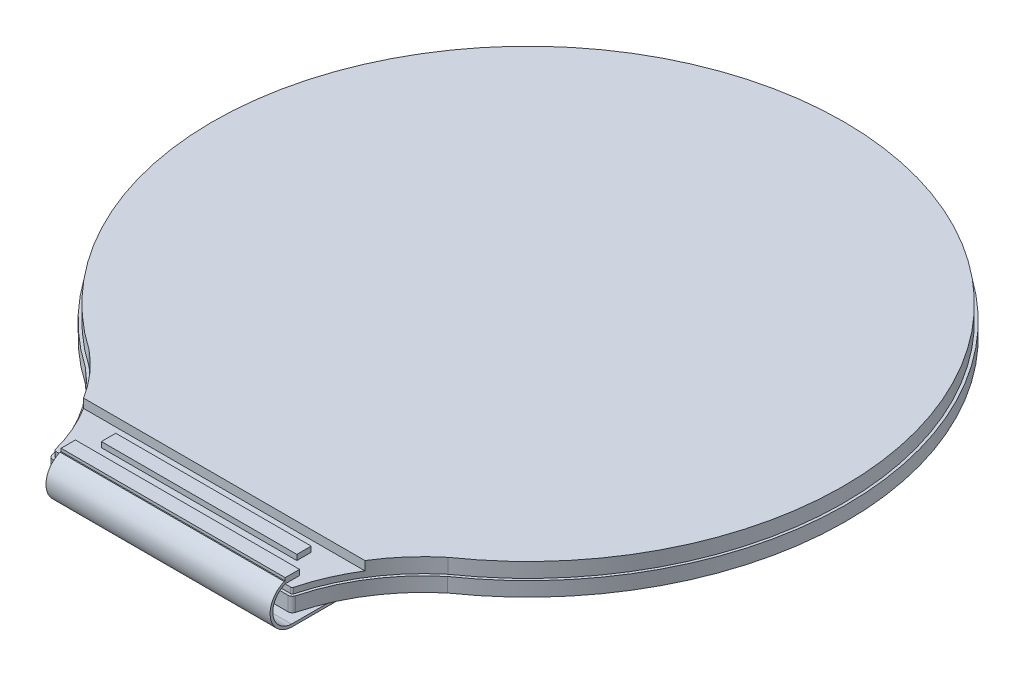
from build123d import *

# Parameters (mm, degrees)
BOSS_EXTRUDE1_DEPTH = 0.8
FILLET1_R           = 0.25
BOSS_EXTRUDE2_DEPTH = 0.82
SKETCH4_W           = 20
SKETCH4_H           = 3
CUT_EXTRUDE1_DEPTH  = 0.5
SKETCH5_W           = 10.9
SKETCH5_H           = 0.8
SKETCH5_W_2         = 12.5
BOSS_EXTRUDE3_DEPTH = 0.3
CUT_EXTRUDE2_DEPTH  = 0.001
BOSS_EXTRUDE4_DEPTH = 6.25
SKETCH9_R           = 0.5
CUT_EXTRUDE3_DEPTH  = 0.2
CUT_EXTRUDE4_DEPTH  = 0.2
FILLET2_R           = 0.5
FILLET3_R           = 0.5
SKETCH11_W          = 0.5
SKETCH11_H          = 2
CUT_EXTRUDE5_DEPTH  = 0.01


with BuildPart() as part:
    # Sketch1 → Boss-Extrude1 (new body)
    with BuildSketch(Plane(origin=(0, 0, 0), x_dir=(1, 0, 0), z_dir=(0, 1, 0))):
        with BuildLine():
            ThreePointArc((10.098638625, -14.597259946), (5.28966615, -16.943492321), (0, -17.75))
            Line((0, -17.75), (0, -19.95))
            Line((0, -19.95), (6.75, -19.95))
            ThreePointArc((6.75, -19.95), (7.990776159, -17.002408255), (10.098638625, -14.597259946))
        make_face()
        with BuildLine():
            Line((0, -19.95), (0, -17.75))
            ThreePointArc((0, -17.75), (-5.28966615, -16.943492321), (-10.098638625, -14.597259946))
            ThreePointArc((-10.098638625, -14.597259946), (-7.990776159, -17.002408255), (-6.75, -19.95))
            Line((-6.75, -19.95), (0, -19.95))
        make_face()
        with BuildLine():
            ThreePointArc((17.75, 0), (12.551145366, 12.551145366), (0, 17.75))
            Line((0, 17.75), (0, -17.75))
            ThreePointArc((0, -17.75), (5.28966615, -16.943492321), (10.098638625, -14.597259946))
            ThreePointArc((10.098638625, -14.597259946), (15.721217122, -8.240499512), (17.75, 0))
        make_face()
        with BuildLine():
            Line((0, -17.75), (0, 17.75))
            ThreePointArc((0, 17.75), (-16.943492321, 5.28966615), (-10.098638625, -14.597259946))
            ThreePointArc((-10.098638625, -14.597259946), (-5.28966615, -16.943492321), (0, -17.75))
        make_face()
    extrude(amount=BOSS_EXTRUDE1_DEPTH)

    # Fillet1
    fillet1_edges = [part.edges().sort_by_distance(p)[0] for p in [
        (6.75, 0.4, 19.95),
        (-6.75, 0.4, 19.95),
    ]]
    fillet(fillet1_edges, radius=FILLET1_R)

    # Sketch2 → Boss-Extrude2 (add)
    with BuildSketch(Plane(origin=(0, 0.8, 0), x_dir=(1, 0, 0), z_dir=(0, 1, 0))):
        with BuildLine():
            Line((-6.555315046, -19.8), (6.555315046, -19.8))
            ThreePointArc((6.555315046, -19.8), (6.616378729, -19.779191076), (6.652029022, -19.725424532))
            ThreePointArc((6.652029022, -19.725424532), (7.917501546, -16.837654003), (10.008059541, -14.477525487))
            ThreePointArc((10.008059541, -14.477525487), (0, 17.6), (-10.008059541, -14.477525487))
            ThreePointArc((-10.008059541, -14.477525487), (-7.917501546, -16.837654003), (-6.652029022, -19.725424532))
            ThreePointArc((-6.652029022, -19.725424532), (-6.616378729, -19.779191076), (-6.555315046, -19.8))
        make_face()
    extrude(amount=BOSS_EXTRUDE2_DEPTH)

    # Sketch4 → Cut-Extrude1 (cut)
    with BuildSketch(Plane(origin=(0, 1.62, 0), x_dir=(1, 0, 0), z_dir=(0, 1, 0))):
        with Locations((0, -18.45)):
            Rectangle(SKETCH4_W, SKETCH4_H)
    extrude(amount=-CUT_EXTRUDE1_DEPTH, mode=Mode.SUBTRACT)

    # Sketch5 → Boss-Extrude3 (add)
    with BuildSketch(Plane(origin=(0, 1.12, 0), x_dir=(1, 0, 0), z_dir=(0, 1, 0))):
        with Locations((0, -17.95)):
            Rectangle(SKETCH5_W, SKETCH5_H)
        with Locations((0, -19.4)):
            Rectangle(SKETCH5_W_2, SKETCH5_H)
    extrude(amount=BOSS_EXTRUDE3_DEPTH)

    # Sketch6 → Cut-Extrude2 (cut)
    # profile 1 of 9: a face of its own
    with BuildSketch(Plane.XZ):
        with BuildLine():
            Line((-8.115384615, -4), (-7.730769231, -4))
            Line((-7.730769231, -4), (-7.730769231, -5.423878205))
            add(Edge.make_bspline(
                [(-7.730769231, -5.423878205), (-7.713359057, -5.406155063), (-7.678704871, -5.370877927), (-7.623058077, -5.32222958), (-7.565824024, -5.276296318), (-7.506110478, -5.234127463), (-7.443693535, -5.196058157), (-7.379151545, -5.161348193), (-7.312721311, -5.129184198), (-7.266695291, -5.111461223), (-7.243589744, -5.102564103)],
                knots=[0, 0, 0, 0, 1.01257393, 2.015483976, 3.011229704, 4.003709975, 4.993558143, 5.98997353, 6.990945526, 8, 8, 8, 8], degree=3))
            Line((-7.243589744, -5.102564103), (-7.243589744, -5.487179487))
            add(Edge.make_bspline(
                [(-7.243589744, -5.487179487), (-7.269206127, -5.496780125), (-7.322819224, -5.516873513), (-7.4019898, -5.559745442), (-7.484809813, -5.612481575), (-7.55429821, -5.664291811), (-7.608950479, -5.710784433), (-7.647434139, -5.747742278), (-7.683081921, -5.785759046), (-7.71458346, -5.825869891), (-7.742738811, -5.867294969), (-7.767686987, -5.909958484), (-7.789646776, -5.953997327), (-7.801142624, -5.984664925), (-7.806891026, -6)],
                knots=[0, 0, 0, 0, 1.253621181, 2.623731602, 4.119264342, 5.756158754, 6.594718004, 7.409281336, 8.202581069, 8.983291728, 9.746205797, 10.498494251, 11.24918464, 12, 12, 12, 12], degree=3))
            Line((-7.806891026, -6), (-8.115384615, -6))
            Line((-8.115384615, -6), (-8.115384615, -4))
        make_face()
    # profile 2 of 9: a face of its own
    with BuildSketch(Plane.XZ):
        with BuildLine():
            add(Edge.make_bspline(
                [(-6.256410256, -6), (-6.280217696, -5.999427681), (-6.326568051, -5.998313441), (-6.394092675, -5.988384763), (-6.457597842, -5.972630411), (-6.517095807, -5.949873464), (-6.572889159, -5.921071609), (-6.624192861, -5.884945541), (-6.672194832, -5.843249183), (-6.699906098, -5.810871154), (-6.713942308, -5.794471154)],
                knots=[0, 0, 0, 0, 1.098626248, 2.138899374, 3.143835643, 4.113754749, 5.073488057, 6.034745239, 7.004566348, 8, 8, 8, 8], degree=3))
            add(Edge.make_bspline(
                [(-6.713942308, -5.794471154), (-6.721971706, -5.784027534), (-6.738358302, -5.762713937), (-6.760427113, -5.728273453), (-6.781644323, -5.691739969), (-6.800160808, -5.652232771), (-6.817907535, -5.610442711), (-6.834289066, -5.566253586), (-6.848753793, -5.519415687), (-6.861363445, -5.470142284), (-6.873150438, -5.418358482), (-6.883024897, -5.363937998), (-6.891475748, -5.30701848), (-6.898066216, -5.247662035), (-6.903975014, -5.185984989), (-6.907208178, -5.12168565), (-6.909857159, -5.054909676), (-6.910121795, -5.009484858), (-6.91025641, -4.986378205)],
                knots=[0, 0, 0, 0, 0.746775751, 1.524038446, 2.317840886, 3.141016509, 3.996283186, 4.892488336, 5.812382473, 6.774967264, 7.776368117, 8.823659909, 9.910833035, 11.039122168, 12.210293276, 13.424012874, 14.68964937, 16, 16, 16, 16], degree=3))
            add(Edge.make_bspline(
                [(-6.91025641, -4.986378205), (-6.910123823, -4.963271499), (-6.90986394, -4.917980046), (-6.907198306, -4.851338037), (-6.903972131, -4.787172759), (-6.898079986, -4.725492419), (-6.891426237, -4.666147773), (-6.883215148, -4.60929205), (-6.872578164, -4.55512162), (-6.860964857, -4.503420376), (-6.848435539, -4.453937659), (-6.833327892, -4.407184318), (-6.817607087, -4.362444446), (-6.799447896, -4.320600625), (-6.780266949, -4.28104453), (-6.759365469, -4.244138144), (-6.737050241, -4.209484218), (-6.720505114, -4.188058179), (-6.712339744, -4.177483974)],
                knots=[0, 0, 0, 0, 1.308411734, 2.564617834, 3.776541518, 4.94597967, 6.0725993, 7.15816376, 8.197872509, 9.197791611, 10.158952087, 11.086962723, 11.979249638, 12.843171697, 13.668427753, 14.467630577, 15.243743175, 16, 16, 16, 16], degree=3))
            add(Edge.make_bspline(
                [(-6.712339744, -4.177483974), (-6.698431943, -4.161224555), (-6.670977274, -4.129127677), (-6.623506763, -4.087776928), (-6.572285892, -4.052396891), (-6.516593565, -4.024171814), (-6.45738522, -4.001262035), (-6.3937766, -3.986013097), (-6.32643646, -3.976064142), (-6.280085266, -3.974935471), (-6.256410256, -3.974358974)],
                knots=[0, 0, 0, 0, 0.991667276, 1.957599061, 2.911530233, 3.873218945, 4.847995157, 5.850445929, 6.902062539, 8, 8, 8, 8], degree=3))
            add(Edge.make_bspline(
                [(-6.256410256, -3.974358974), (-6.232465306, -3.975047809), (-6.185543935, -3.976397615), (-6.117038725, -3.987102948), (-6.05191365, -4.004240276), (-5.990438846, -4.02875213), (-5.932500524, -4.060395455), (-5.878230627, -4.098928669), (-5.828012004, -4.1449143), (-5.788771275, -4.187788789), (-5.760262586, -4.226505545), (-5.739643325, -4.258394149), (-5.720472285, -4.29299406), (-5.703437474, -4.330736183), (-5.686809514, -4.370661161), (-5.672137696, -4.413526128), (-5.65898602, -4.459031002), (-5.646793755, -4.507214043), (-5.636697895, -4.558359763), (-5.627313567, -4.612021724), (-5.619863903, -4.668448556), (-5.613356728, -4.727475057), (-5.608740431, -4.78935478), (-5.604999189, -4.853860171), (-5.603121636, -4.921196211), (-5.602752435, -4.967013016), (-5.602564103, -4.990384615)],
                knots=[0, 0, 0, 0, 1.257950952, 2.465020067, 3.634655077, 4.790733554, 5.934021429, 7.096707277, 8.279410303, 9.50697689, 10.144297186, 10.804287671, 11.501695772, 12.220839511, 12.979421332, 13.77406523, 14.600317561, 15.468494278, 16.385246419, 17.339518343, 18.331157269, 19.375991271, 20.460161903, 21.591951756, 22.771631055, 24, 24, 24, 24], degree=3))
            add(Edge.make_bspline(
                [(-5.602564103, -4.990384615), (-5.602695692, -5.013357851), (-5.602953589, -5.058382439), (-5.605637797, -5.124756264), (-5.608824425, -5.188657348), (-5.614769652, -5.250199621), (-5.621368662, -5.309281919), (-5.629593905, -5.366008127), (-5.640430063, -5.419965061), (-5.651128206, -5.471752379), (-5.664608128, -5.520863014), (-5.679458743, -5.5675812), (-5.69512742, -5.612221036), (-5.713471985, -5.653848491), (-5.732541897, -5.693319606), (-5.753458016, -5.730219515), (-5.77576956, -5.764875072), (-5.792315163, -5.786300899), (-5.800480769, -5.796875)],
                knots=[0, 0, 0, 0, 1.304443357, 2.556541329, 3.771813033, 4.936929721, 6.066661712, 7.147723817, 8.190304831, 9.191350322, 10.149780912, 11.080355239, 11.975107155, 12.834450748, 13.66198663, 14.463397305, 15.241653965, 16, 16, 16, 16], degree=3))
            add(Edge.make_bspline(
                [(-5.800480769, -5.796875), (-5.814389335, -5.813132855), (-5.841845514, -5.845226646), (-5.889304971, -5.886599997), (-5.940469275, -5.921827975), (-5.99599909, -5.950394985), (-6.055343477, -5.972994929), (-6.11903545, -5.98836653), (-6.186386321, -5.998289296), (-6.232736014, -5.999421632), (-6.256410256, -6)],
                knots=[0, 0, 0, 0, 0.991631672, 1.957528776, 2.911425699, 3.867574088, 4.848108326, 5.850523106, 6.902101959, 8, 8, 8, 8], degree=3))
        make_face()
        with BuildLine():
            add(Edge.make_bspline(
                [(-6.256410256, -5.666666667), (-6.244074324, -5.666136157), (-6.219933376, -5.665097971), (-6.184823503, -5.656632254), (-6.151661361, -5.643519267), (-6.120545281, -5.624261411), (-6.091728132, -5.598186166), (-6.067312377, -5.562952189), (-6.046205369, -5.519763078), (-6.035646151, -5.487472), (-6.030048077, -5.470352564)],
                knots=[0, 0, 0, 0, 0.909107913, 1.77908945, 2.650019014, 3.530482969, 4.465025013, 5.495890128, 6.672421267, 8, 8, 8, 8], degree=3))
            add(Edge.make_bspline(
                [(-6.030048077, -5.470352564), (-6.026551497, -5.457436105), (-6.01903642, -5.429675215), (-6.01051141, -5.38441298), (-6.003442602, -5.332915663), (-5.99758639, -5.275446586), (-5.992677421, -5.211868318), (-5.989731855, -5.142249731), (-5.987667073, -5.066385187), (-5.987346341, -5.013756948), (-5.987179487, -4.986378205)],
                knots=[0, 0, 0, 0, 0.658987911, 1.416339426, 2.266699053, 3.21915829, 4.261587229, 5.407491103, 6.651301334, 8, 8, 8, 8], degree=3))
            add(Edge.make_bspline(
                [(-5.987179487, -4.986378205), (-5.987161379, -4.959132103), (-5.987126666, -4.90690178), (-5.989476176, -4.83198716), (-5.991807619, -4.76369156), (-5.996558042, -4.702019094), (-6.001188096, -4.646875537), (-6.008340993, -4.598577808), (-6.015397388, -4.556683035), (-6.027530885, -4.511311525), (-6.044043928, -4.463608126), (-6.066433453, -4.415139825), (-6.092028856, -4.377296398), (-6.120929179, -4.349523173), (-6.152548815, -4.331310842), (-6.18495109, -4.316809368), (-6.220172356, -4.309539108), (-6.244232295, -4.308312936), (-6.256410256, -4.307692308)],
                knots=[0, 0, 0, 0, 1.613423711, 3.092906249, 4.438549176, 5.659614359, 6.755866972, 7.714404598, 8.550538197, 9.269895343, 10.493007835, 11.536555847, 12.422911196, 13.183806183, 13.886403663, 14.573882011, 15.278168965, 16, 16, 16, 16], degree=3))
            add(Edge.make_bspline(
                [(-6.256410256, -4.307692308), (-6.268605933, -4.308251161), (-6.292730095, -4.309356625), (-6.327794027, -4.317549183), (-6.360909019, -4.33106869), (-6.392234707, -4.349941747), (-6.421078872, -4.376196766), (-6.445512464, -4.41139911), (-6.466613831, -4.454598224), (-6.477173907, -4.486887781), (-6.482772436, -4.50400641)],
                knots=[0, 0, 0, 0, 0.899391665, 1.779078861, 2.640979247, 3.529945348, 4.464599804, 5.495588918, 6.672261578, 8, 8, 8, 8], degree=3))
            add(Edge.make_bspline(
                [(-6.482772436, -4.50400641), (-6.486263756, -4.516923915), (-6.493733321, -4.544560491), (-6.502322901, -4.589540582), (-6.509375473, -4.640641815), (-6.51525811, -4.697841463), (-6.52013883, -4.761289181), (-6.523090003, -4.830907185), (-6.525149199, -4.906638403), (-6.52547298, -4.959133037), (-6.525641026, -4.986378205)],
                knots=[0, 0, 0, 0, 0.66114423, 1.414496391, 2.261103113, 3.210114492, 4.255954433, 5.405607896, 6.653488082, 8, 8, 8, 8], degree=3))
            add(Edge.make_bspline(
                [(-6.525641026, -4.986378205), (-6.525413648, -5.013621499), (-6.524977804, -5.065842323), (-6.523721733, -5.140928013), (-6.520219482, -5.209290888), (-6.516675159, -5.271199223), (-6.510797662, -5.326327328), (-6.504884367, -5.374956963), (-6.496733827, -5.416755552), (-6.485614863, -5.462220605), (-6.468787452, -5.509798478), (-6.445744029, -5.557829344), (-6.420860175, -5.596382268), (-6.391848323, -5.624292649), (-6.360411507, -5.64336715), (-6.32750697, -5.656728862), (-6.292608623, -5.665047942), (-6.26860887, -5.666121167), (-6.256410256, -5.666666667)],
                knots=[0, 0, 0, 0, 1.611417923, 3.08881791, 4.440977692, 5.659943609, 6.755562938, 7.719628481, 8.556148141, 9.272628506, 10.486722334, 11.532371909, 12.419634995, 13.184996863, 13.890817922, 14.581674456, 15.27909232, 16, 16, 16, 16], degree=3))
        make_face(mode=Mode.SUBTRACT)
    # profile 3 of 9: a face of its own
    with BuildSketch(Plane.XZ):
        Polygon((-5.423076923, -4), (-5.015224359, -4), (-4.846554487, -4.461538462), (-4.078926282, -4.461538462), (-3.91025641, -4), (-3.5, -4), (-4.256009615, -6), (-4.663461538, -6), align=None)
        Polygon((-4.724358974, -4.794871795), (-4.461538462, -5.512820513), (-4.199519231, -4.794871795), align=None, mode=Mode.SUBTRACT)
    # profile 4 of 9: a face of its own
    with BuildSketch(Plane.XZ):
        with BuildLine():
            Line((-2.115384615, -4.49599359), (-2.5, -4.538461538))
            add(Edge.make_bspline(
                [(-2.5, -4.538461538), (-2.502538885, -4.520057279), (-2.507337899, -4.48526945), (-2.522285404, -4.437439312), (-2.54216032, -4.396898583), (-2.567843688, -4.363987158), (-2.598596488, -4.338666081), (-2.633777288, -4.320052272), (-2.673970178, -4.309692804), (-2.702132462, -4.308375763), (-2.716746795, -4.307692308)],
                knots=[0, 0, 0, 0, 1.262235458, 2.385884198, 3.393637974, 4.318874272, 5.203045307, 6.084972486, 7.006229446, 8, 8, 8, 8], degree=3))
            add(Edge.make_bspline(
                [(-2.716746795, -4.307692308), (-2.726264256, -4.307910874), (-2.745073481, -4.308342822), (-2.772569696, -4.314517468), (-2.799140429, -4.322985849), (-2.824370626, -4.335985264), (-2.848846756, -4.351743057), (-2.871654346, -4.371896397), (-2.893984694, -4.394780241), (-2.915096397, -4.422003377), (-2.934718225, -4.454817168), (-2.952114602, -4.494579272), (-2.968093633, -4.541438651), (-2.981335457, -4.59596416), (-2.993225745, -4.657615379), (-3.00357851, -4.726575181), (-3.011975253, -4.802890254), (-3.015686916, -4.856286978), (-3.017628205, -4.884214744)],
                knots=[0, 0, 0, 0, 0.636795783, 1.258490563, 1.881473832, 2.502200491, 3.155406741, 3.828504161, 4.537797627, 5.297264319, 6.132700238, 7.094659335, 8.201903097, 9.448545208, 10.853500302, 12.411215883, 14.122979992, 16, 16, 16, 16], degree=3))
            add(Edge.make_bspline(
                [(-3.017628205, -4.884214744), (-3.005323968, -4.871008445), (-2.981064379, -4.84497031), (-2.94088495, -4.81080931), (-2.898104216, -4.782088841), (-2.852941039, -4.758939133), (-2.805866578, -4.740025738), (-2.75610689, -4.727584847), (-2.704354816, -4.719049159), (-2.668972825, -4.718318837), (-2.651041667, -4.717948718)],
                knots=[0, 0, 0, 0, 1.041520616, 2.053509057, 3.037255372, 4.009786987, 4.979165048, 5.959157055, 6.965725879, 8, 8, 8, 8], degree=3))
            add(Edge.make_bspline(
                [(-2.651041667, -4.717948718), (-2.631389048, -4.718527555), (-2.592586595, -4.719670419), (-2.535398826, -4.727541076), (-2.480618992, -4.74213349), (-2.42736586, -4.76048138), (-2.37676676, -4.785867209), (-2.327937001, -4.815968157), (-2.281307737, -4.8519055), (-2.237335783, -4.892933918), (-2.196359678, -4.937765794), (-2.160973039, -4.986895093), (-2.131354173, -5.039475315), (-2.106096161, -5.094759727), (-2.087522201, -5.153781745), (-2.073743079, -5.215815561), (-2.065754226, -5.281309026), (-2.064660641, -5.32610045), (-2.064102564, -5.348958333)],
                knots=[0, 0, 0, 0, 0.980489948, 1.935895517, 2.871513234, 3.805041138, 4.740635134, 5.689092885, 6.663201422, 7.672073258, 8.68627675, 9.688482882, 10.685092783, 11.69304024, 12.714917622, 13.76564325, 14.859766867, 16, 16, 16, 16], degree=3))
            add(Edge.make_bspline(
                [(-2.064102564, -5.348958333), (-2.064613441, -5.372756322), (-2.065615563, -5.419437794), (-2.074271451, -5.487520331), (-2.087794134, -5.552194191), (-2.106887038, -5.613418529), (-2.132376259, -5.670871787), (-2.162948424, -5.724832269), (-2.198735621, -5.775474654), (-2.240478353, -5.821470169), (-2.285872873, -5.863567601), (-2.334837533, -5.900203546), (-2.387094365, -5.930820341), (-2.442178805, -5.956264113), (-2.500504503, -5.975859516), (-2.561698574, -5.989823589), (-2.625820555, -5.998482045), (-2.669576922, -5.999487094), (-2.691907051, -6)],
                knots=[0, 0, 0, 0, 1.123798938, 2.204412733, 3.236327067, 4.241910921, 5.227709292, 6.199561491, 7.167597742, 8.150444554, 9.128196284, 10.088368653, 11.032911791, 11.984193579, 12.949759927, 13.933760113, 14.945538548, 16, 16, 16, 16], degree=3))
            add(Edge.make_bspline(
                [(-2.691907051, -6), (-2.716253581, -5.999332976), (-2.763994259, -5.998025022), (-2.833921865, -5.986962012), (-2.900361098, -5.968587282), (-2.963341859, -5.942473286), (-3.023497146, -5.910148387), (-3.079962711, -5.869539804), (-3.132759959, -5.821597219), (-3.182613405, -5.766773121), (-3.227985644, -5.703456773), (-3.266611797, -5.630270099), (-3.299468717, -5.54791691), (-3.325989358, -5.456217149), (-3.346712225, -5.35519528), (-3.361014872, -5.24485296), (-3.370585368, -5.125168416), (-3.37138179, -5.042221171), (-3.371794872, -4.999198718)],
                knots=[0, 0, 0, 0, 0.854891567, 1.676341694, 2.47995431, 3.271020815, 4.066664888, 4.873816552, 5.707593207, 6.567874418, 7.472647967, 8.436057837, 9.467542118, 10.582426215, 11.784991051, 13.086771462, 14.488988534, 16, 16, 16, 16], degree=3))
            add(Edge.make_bspline(
                [(-3.371794872, -4.999198718), (-3.37119747, -4.955510818), (-3.370043264, -4.871103974), (-3.360740665, -4.749249047), (-3.34599274, -4.636743389), (-3.324386686, -4.533750641), (-3.297039751, -4.440073605), (-3.263486735, -4.355599696), (-3.223525052, -4.280555236), (-3.177015193, -4.214981352), (-3.125332685, -4.158433263), (-3.070305111, -4.109047004), (-3.011304768, -4.067579812), (-2.948937943, -4.032964991), (-2.882230101, -4.007049674), (-2.812115441, -3.988272886), (-2.738402342, -3.976109923), (-2.68794914, -3.974949721), (-2.662259615, -3.974358974)],
                knots=[0, 0, 0, 0, 1.487370886, 2.873662544, 4.158543041, 5.348235379, 6.453208071, 7.477453386, 8.437714953, 9.341093255, 10.207028537, 11.041196462, 11.853665925, 12.657500357, 13.463902956, 14.28346725, 15.125983907, 16, 16, 16, 16], degree=3))
            add(Edge.make_bspline(
                [(-2.662259615, -3.974358974), (-2.643815227, -3.974739444), (-2.607626478, -3.975485942), (-2.554637656, -3.981465168), (-2.504380387, -3.991921468), (-2.456869827, -4.006317817), (-2.412159099, -4.024793351), (-2.370262568, -4.047324663), (-2.331015071, -4.073996804), (-2.294573287, -4.104958771), (-2.260871802, -4.139732904), (-2.230537694, -4.178773497), (-2.203323097, -4.221704772), (-2.179242133, -4.268801146), (-2.158570445, -4.31997805), (-2.140370271, -4.374886312), (-2.126115884, -4.434053897), (-2.119024877, -4.474982402), (-2.115384615, -4.49599359)],
                knots=[0, 0, 0, 0, 1.057027873, 2.073937905, 3.051241742, 3.995584831, 4.915316114, 5.819466587, 6.717537412, 7.630009354, 8.555709682, 9.488220895, 10.458665953, 11.465151209, 12.515617772, 13.619420594, 14.77789816, 16, 16, 16, 16], degree=3))
        make_face()
        with BuildLine():
            add(Edge.make_bspline(
                [(-2.987179487, -5.339342949), (-2.987056721, -5.352050026), (-2.986818126, -5.376746232), (-2.981880745, -5.412411004), (-2.975993887, -5.446117587), (-2.965987087, -5.477335279), (-2.954382211, -5.506949167), (-2.938652808, -5.533623725), (-2.921705372, -5.559044064), (-2.894389474, -5.588154359), (-2.857510646, -5.61957972), (-2.807856894, -5.646296785), (-2.755202225, -5.664061251), (-2.718492578, -5.665791349), (-2.699919872, -5.666666667)],
                knots=[0, 0, 0, 0, 0.937356689, 1.821752902, 2.655368738, 3.460194657, 4.238543, 4.998172835, 5.742279907, 6.489256967, 7.938836255, 9.298111323, 10.633019148, 12, 12, 12, 12], degree=3))
            add(Edge.make_bspline(
                [(-2.699919872, -5.666666667), (-2.682598606, -5.66588454), (-2.648884641, -5.664362215), (-2.600822677, -5.6506291), (-2.557206725, -5.628626617), (-2.525253274, -5.602773612), (-2.503048227, -5.577566736), (-2.488401583, -5.555453924), (-2.476105375, -5.530672196), (-2.466057663, -5.502959403), (-2.458135959, -5.472656522), (-2.452530895, -5.439413282), (-2.449476929, -5.403503356), (-2.44897604, -5.378611326), (-2.448717949, -5.365785256)],
                knots=[0, 0, 0, 0, 1.397302724, 2.719698124, 4.003613788, 5.323408171, 6.011772029, 6.712213366, 7.460338566, 8.242264961, 9.090431688, 9.988233825, 10.963401025, 12, 12, 12, 12], degree=3))
            add(Edge.make_bspline(
                [(-2.448717949, -5.365785256), (-2.448929741, -5.352688691), (-2.449339064, -5.327377418), (-2.453014916, -5.290682881), (-2.458869751, -5.256763729), (-2.467179819, -5.225387523), (-2.478674793, -5.197007665), (-2.491452997, -5.170625706), (-2.507949675, -5.147733559), (-2.531680237, -5.120523679), (-2.566577581, -5.09300168), (-2.613392075, -5.068140981), (-2.665731003, -5.054001473), (-2.702108756, -5.052203536), (-2.720753205, -5.051282051)],
                knots=[0, 0, 0, 0, 0.999880898, 1.932434667, 2.812666229, 3.626598965, 4.404934333, 5.148346347, 5.858487845, 6.552107857, 7.901111139, 9.223917689, 10.577192964, 12, 12, 12, 12], degree=3))
            add(Edge.make_bspline(
                [(-2.720753205, -5.051282051), (-2.738884041, -5.052003264), (-2.774261904, -5.053410535), (-2.824742969, -5.068089985), (-2.870732951, -5.091396702), (-2.904670016, -5.118101582), (-2.928828706, -5.143517172), (-2.944404163, -5.165314905), (-2.95769774, -5.189100798), (-2.968609602, -5.21502296), (-2.976922593, -5.243122575), (-2.982876194, -5.27329911), (-2.986553983, -5.305598251), (-2.986966407, -5.327847689), (-2.987179487, -5.339342949)],
                knots=[0, 0, 0, 0, 1.470673089, 2.869656536, 4.234169822, 5.641680789, 6.356077167, 7.079330037, 7.813342698, 8.567555865, 9.361073787, 10.191542707, 11.065653458, 12, 12, 12, 12], degree=3))
        make_face(mode=Mode.SUBTRACT)
    # profile 5 of 9: a face of its own
    with BuildSketch(Plane.XZ):
        with BuildLine():
            Line((-1.448717949, -4.743589744), (-1.833333333, -4.615384615))
            add(Edge.make_bspline(
                [(-1.833333333, -4.615384615), (-1.825520314, -4.5901642), (-1.810219965, -4.540774693), (-1.782063337, -4.470024095), (-1.750072731, -4.404259121), (-1.714424748, -4.343474759), (-1.67492646, -4.287923466), (-1.632097762, -4.237046948), (-1.584884044, -4.191687005), (-1.5342323, -4.151004004), (-1.479892618, -4.115218077), (-1.421946757, -4.08427476), (-1.360498845, -4.058245683), (-1.295462212, -4.037014862), (-1.227080793, -4.020056766), (-1.155070018, -4.008844944), (-1.079756568, -4.001246068), (-1.02833186, -4.000421941), (-1.002003205, -4)],
                knots=[0, 0, 0, 0, 1.126762081, 2.206554606, 3.2467965, 4.246020947, 5.21092796, 6.153291325, 7.08058397, 8.001175813, 8.922984798, 9.853897815, 10.801574477, 11.767861444, 12.771677589, 13.805432109, 14.876415158, 16, 16, 16, 16], degree=3))
            add(Edge.make_bspline(
                [(-1.002003205, -4), (-0.969505727, -4.000671818), (-0.905582216, -4.001993304), (-0.812101679, -4.015301245), (-0.723013082, -4.0360532), (-0.638216395, -4.064824513), (-0.55811454, -4.102814818), (-0.482512779, -4.149039451), (-0.411506907, -4.203736657), (-0.345219882, -4.265894606), (-0.285134529, -4.335463389), (-0.23273347, -4.411839737), (-0.188153634, -4.494102968), (-0.151948742, -4.582661963), (-0.123918009, -4.677304487), (-0.104195242, -4.778046692), (-0.091870352, -4.884843796), (-0.090464897, -4.95803156), (-0.08974359, -4.995592949)],
                knots=[0, 0, 0, 0, 1.02522974, 2.016657555, 2.973721079, 3.909558628, 4.837319625, 5.766343924, 6.701393111, 7.661672698, 8.630097109, 9.597098371, 10.579821742, 11.577930606, 12.611584243, 13.690460057, 14.814699019, 16, 16, 16, 16], degree=3))
            add(Edge.make_bspline(
                [(-0.08974359, -4.995592949), (-0.090480256, -5.035152841), (-0.091917357, -5.112326972), (-0.104010592, -5.224628303), (-0.124112265, -5.33016394), (-0.151232624, -5.42917023), (-0.187814573, -5.521000445), (-0.231127377, -5.606615872), (-0.283903235, -5.684686464), (-0.343333458, -5.756041695), (-0.409632995, -5.819382975), (-0.481284052, -5.874713492), (-0.558139734, -5.921208817), (-0.639808357, -5.959786765), (-0.726690399, -5.989262708), (-0.818585613, -6.010608745), (-0.915526258, -6.023011248), (-0.981802269, -6.024752441), (-1.015625, -6.025641026)],
                knots=[0, 0, 0, 0, 1.212707478, 2.365771018, 3.457929809, 4.504086506, 5.507768342, 6.483850487, 7.440071508, 8.390568156, 9.325987041, 10.245716599, 11.160730876, 12.074755155, 13.009663076, 13.968134536, 14.963075189, 16, 16, 16, 16], degree=3))
            add(Edge.make_bspline(
                [(-1.015625, -6.025641026), (-1.045165379, -6.024901071), (-1.103083222, -6.023450292), (-1.187873097, -6.013474438), (-1.268363489, -5.996286832), (-1.344461457, -5.972012504), (-1.416696149, -5.941776123), (-1.484207328, -5.903726781), (-1.547793453, -5.859224429), (-1.58608977, -5.82441467), (-1.60536859, -5.806891026)],
                knots=[0, 0, 0, 0, 1.098573301, 2.153899152, 3.169959448, 4.154852821, 5.120726819, 6.076884781, 7.031881026, 8, 8, 8, 8], degree=3))
            add(Edge.make_bspline(
                [(-1.60536859, -5.806891026), (-1.616544636, -5.795743659), (-1.639159247, -5.773187082), (-1.669329337, -5.735089256), (-1.698112612, -5.694048801), (-1.724345259, -5.649228151), (-1.748454817, -5.600862516), (-1.77032669, -5.549151716), (-1.790634692, -5.493998121), (-1.801907413, -5.455601616), (-1.807692308, -5.435897436)],
                knots=[0, 0, 0, 0, 0.885321605, 1.791438769, 2.723025903, 3.697505786, 4.703199598, 5.754404901, 6.847613555, 8, 8, 8, 8], degree=3))
            Line((-1.807692308, -5.435897436), (-1.423076923, -5.358974359))
            add(Edge.make_bspline(
                [(-1.423076923, -5.358974359), (-1.419807885, -5.371589801), (-1.413368739, -5.396438912), (-1.400339361, -5.432145119), (-1.385396045, -5.466029427), (-1.366866262, -5.497251138), (-1.347214313, -5.527239012), (-1.323888916, -5.554444656), (-1.298878953, -5.580218264), (-1.271100739, -5.603388907), (-1.241351284, -5.624291211), (-1.209930496, -5.642679836), (-1.176761506, -5.65802887), (-1.142094953, -5.670313654), (-1.106047058, -5.680639684), (-1.068274167, -5.687012761), (-1.029106957, -5.691907089), (-1.002420711, -5.692172201), (-0.988782051, -5.692307692)],
                knots=[0, 0, 0, 0, 1.051114734, 2.070420253, 3.064047898, 4.034553068, 4.997066449, 5.953344811, 6.921213386, 7.892675544, 8.867420182, 9.852654213, 10.826683617, 11.811917648, 12.818610352, 13.848120519, 14.900229319, 16, 16, 16, 16], degree=3))
            add(Edge.make_bspline(
                [(-0.988782051, -5.692307692), (-0.970053949, -5.69191745), (-0.933370001, -5.691153058), (-0.879909501, -5.683064202), (-0.829027078, -5.671390223), (-0.780904341, -5.653964189), (-0.735675066, -5.631354798), (-0.692680651, -5.604489206), (-0.65301685, -5.572070368), (-0.615738934, -5.53516514), (-0.582323019, -5.49227131), (-0.552917158, -5.443559934), (-0.528530219, -5.38842507), (-0.508729644, -5.327422987), (-0.493144989, -5.260404153), (-0.482016138, -5.187283937), (-0.475861594, -5.108011924), (-0.474870656, -5.05316205), (-0.474358974, -5.024839744)],
                knots=[0, 0, 0, 0, 0.93816214, 1.837638998, 2.704791736, 3.551915875, 4.396257554, 5.235807848, 6.087970119, 6.959042444, 7.860386085, 8.80649345, 9.804409709, 10.875695391, 12.017327537, 13.250155505, 14.580089023, 16, 16, 16, 16], degree=3))
            add(Edge.make_bspline(
                [(-0.474358974, -5.024839744), (-0.474865977, -4.994782037), (-0.475842893, -4.936865466), (-0.481991342, -4.853324688), (-0.493207589, -4.776494555), (-0.508503769, -4.706339797), (-0.528529842, -4.642849899), (-0.552951603, -4.585990324), (-0.581514972, -4.535464412), (-0.615393036, -4.492135005), (-0.652579196, -4.454756233), (-0.692229645, -4.422112307), (-0.734742191, -4.394644658), (-0.77979981, -4.371973453), (-0.827773112, -4.354850736), (-0.878233373, -4.342425695), (-0.931375165, -4.334528741), (-0.967786895, -4.333737387), (-0.986378205, -4.333333333)],
                knots=[0, 0, 0, 0, 1.475358314, 2.842788217, 4.10813974, 5.28337307, 6.36340737, 7.370420267, 8.315974046, 9.203613532, 10.061092951, 10.899546145, 11.719527401, 12.540320428, 13.369705655, 14.21387866, 15.088031885, 16, 16, 16, 16], degree=3))
            add(Edge.make_bspline(
                [(-0.986378205, -4.333333333), (-1.000142556, -4.333676732), (-1.02720811, -4.334351975), (-1.067213084, -4.338637689), (-1.105609701, -4.346816357), (-1.142585899, -4.357631165), (-1.178285344, -4.371200558), (-1.212163501, -4.388607361), (-1.244886908, -4.408613897), (-1.275776582, -4.432060023), (-1.305246149, -4.458382776), (-1.332124144, -4.488805318), (-1.357055715, -4.522596665), (-1.379724568, -4.559982644), (-1.400888142, -4.600643246), (-1.418894219, -4.645211983), (-1.435668493, -4.692968605), (-1.444292155, -4.72642131), (-1.448717949, -4.743589744)],
                knots=[0, 0, 0, 0, 0.980177776, 1.927374078, 2.859849964, 3.771585772, 4.668674471, 5.574490016, 6.479656464, 7.396337719, 8.332153134, 9.288470092, 10.28125149, 11.318486971, 12.398724812, 13.541284404, 14.738150009, 16, 16, 16, 16], degree=3))
        make_face()
    # profile 6 of 9: a face of its own
    with BuildSketch(Plane.XZ):
        with BuildLine():
            Line((1.08974359, -4.743589744), (1.08974359, -5.076923077))
            Line((1.08974359, -5.076923077), (0.217948718, -5.076923077))
            Line((0.217948718, -5.076923077), (0.217948718, -4.273237179))
            add(Edge.make_bspline(
                [(0.217948718, -4.273237179), (0.228920749, -4.263357131), (0.2513498, -4.243160314), (0.287945329, -4.214677749), (0.328233559, -4.187485482), (0.371970939, -4.1610328), (0.419247984, -4.135532609), (0.469876128, -4.110629755), (0.523948782, -4.086567781), (0.600415421, -4.056425239), (0.698843661, -4.023627662), (0.819174151, -3.995109103), (0.940456534, -3.977617545), (1.02157815, -3.975444458), (1.062099359, -3.974358974)],
                knots=[0, 0, 0, 0, 0.581799769, 1.189316438, 1.825828404, 2.496525428, 3.203088405, 3.942228803, 4.719818701, 5.534979611, 7.181138583, 8.803804008, 10.403462225, 12, 12, 12, 12], degree=3))
            add(Edge.make_bspline(
                [(1.062099359, -3.974358974), (1.087483344, -3.974745977), (1.137522729, -3.975508873), (1.211413454, -3.981482172), (1.282769234, -3.992143234), (1.351829225, -4.005775552), (1.418124825, -4.024486217), (1.482121851, -4.046736941), (1.543338381, -4.073889758), (1.602406462, -4.103991941), (1.657930089, -4.138763433), (1.71084738, -4.176070397), (1.75917473, -4.218272218), (1.804839334, -4.262887325), (1.845930088, -4.311864752), (1.884513977, -4.36347692), (1.918227402, -4.419517539), (1.949047647, -4.478225874), (1.97627529, -4.539370044), (1.999288261, -4.602436846), (2.019453368, -4.666546556), (2.036029543, -4.731914567), (2.048203273, -4.798756002), (2.057667068, -4.86676089), (2.062750005, -4.93635432), (2.06364865, -4.983165893), (2.064102564, -5.006810897)],
                knots=[0, 0, 0, 0, 1.124849521, 2.217412964, 3.282033297, 4.320826982, 5.334570186, 6.332223418, 7.32072424, 8.300094412, 9.267445991, 10.221673906, 11.165939382, 12.107530405, 13.047948964, 13.99608269, 14.960333572, 15.942435804, 16.933325446, 17.923861552, 18.91593462, 19.910652045, 20.910059116, 21.925321399, 22.952058651, 24, 24, 24, 24], degree=3))
            add(Edge.make_bspline(
                [(2.064102564, -5.006810897), (2.063734793, -5.032331506), (2.063009756, -5.082643654), (2.056750084, -5.157002241), (2.047055584, -5.229190278), (2.032260493, -5.299037407), (2.014572219, -5.367053406), (1.991773904, -5.432694632), (1.966063868, -5.496669776), (1.935385758, -5.557777856), (1.901611071, -5.616442214), (1.863393552, -5.671395376), (1.821481277, -5.72282702), (1.776354512, -5.771197141), (1.726652978, -5.81525021), (1.673607988, -5.856128679), (1.617216566, -5.894291902), (1.576863354, -5.915815937), (1.556490385, -5.926682692)],
                knots=[0, 0, 0, 0, 1.105073865, 2.178578186, 3.229645659, 4.257331163, 5.268841966, 6.27115023, 7.26464218, 8.25271518, 9.229825896, 10.194064933, 11.147944697, 12.101280735, 13.055668865, 14.020497492, 15.000616287, 16, 16, 16, 16], degree=3))
            add(Edge.make_bspline(
                [(1.556490385, -5.926682692), (1.540315683, -5.934694336), (1.507575236, -5.950911314), (1.45542905, -5.970659255), (1.400693897, -5.988108694), (1.342730945, -6.001438373), (1.282157987, -6.012230468), (1.218675833, -6.020433959), (1.152167416, -6.024614879), (1.106842568, -6.025294517), (1.083733974, -6.025641026)],
                knots=[0, 0, 0, 0, 0.887950456, 1.797368171, 2.741221183, 3.713797788, 4.722103116, 5.768966405, 6.862521341, 8, 8, 8, 8], degree=3))
            add(Edge.make_bspline(
                [(1.083733974, -6.025641026), (1.053938974, -6.025197226), (0.995993209, -6.024334119), (0.91151262, -6.017142211), (0.832005347, -6.004747195), (0.757360669, -5.987675884), (0.687739394, -5.96572671), (0.623261374, -5.938742851), (0.563530858, -5.907267349), (0.50941297, -5.870038755), (0.459807836, -5.828989874), (0.414844899, -5.784070774), (0.374506062, -5.735214922), (0.338764637, -5.682668147), (0.307901934, -5.626213251), (0.281365903, -5.566365115), (0.259523538, -5.502669392), (0.248967607, -5.458433841), (0.243589744, -5.435897436)],
                knots=[0, 0, 0, 0, 1.271135529, 2.472123572, 3.614091059, 4.701890498, 5.736279567, 6.724681829, 7.680621489, 8.611506429, 9.52200816, 10.424540711, 11.318996785, 12.221421405, 13.131851814, 14.060431888, 15.011860567, 16, 16, 16, 16], degree=3))
            Line((0.243589744, -5.435897436), (0.628205128, -5.358974359))
            add(Edge.make_bspline(
                [(0.628205128, -5.358974359), (0.632010292, -5.371597414), (0.63951781, -5.396502465), (0.654130963, -5.432216585), (0.670767206, -5.465988876), (0.690421193, -5.497286265), (0.711296502, -5.527298466), (0.735836869, -5.554323061), (0.761650906, -5.580374659), (0.790633218, -5.603403524), (0.821510328, -5.624173564), (0.853953264, -5.642900165), (0.888689949, -5.658087565), (0.925235195, -5.670307305), (0.963410005, -5.680685139), (1.00371268, -5.687067535), (1.045690599, -5.691881099), (1.07437065, -5.692163971), (1.088942308, -5.692307692)],
                knots=[0, 0, 0, 0, 1.027780279, 2.027791312, 3.006028774, 3.96000864, 4.908113241, 5.852721087, 6.802883308, 7.765918715, 8.733730415, 9.704005314, 10.683351261, 11.68471758, 12.707948499, 13.764514378, 14.864202456, 16, 16, 16, 16], degree=3))
            add(Edge.make_bspline(
                [(1.088942308, -5.692307692), (1.110997021, -5.691719265), (1.154038675, -5.6905709), (1.216873752, -5.683077569), (1.276152883, -5.669746246), (1.332031079, -5.651358227), (1.384610781, -5.627755918), (1.433181474, -5.598059001), (1.47895254, -5.564024688), (1.520621494, -5.524079974), (1.5584105, -5.479290535), (1.591123645, -5.42912213), (1.618357198, -5.373736924), (1.64066303, -5.313413022), (1.658423232, -5.248147909), (1.670471528, -5.177710545), (1.678343665, -5.102208989), (1.679098185, -5.050101361), (1.679487179, -5.023237179)],
                knots=[0, 0, 0, 0, 1.043810997, 2.037086103, 2.989314757, 3.91471467, 4.817033861, 5.710208705, 6.603920097, 7.511448416, 8.435617211, 9.371747005, 10.338444094, 11.350425613, 12.411431869, 13.5347293, 14.729025275, 16, 16, 16, 16], degree=3))
            add(Edge.make_bspline(
                [(1.679487179, -5.023237179), (1.679082042, -4.994373228), (1.678294633, -4.938274455), (1.670621961, -4.856995115), (1.658035431, -4.78125355), (1.639866778, -4.71121327), (1.617409094, -4.646451567), (1.589063957, -4.587403502), (1.555972853, -4.533863512), (1.517445934, -4.486393134), (1.475369735, -4.444119461), (1.429651972, -4.407570706), (1.380608772, -4.376898963), (1.328717275, -4.351451269), (1.273463515, -4.331772055), (1.215039713, -4.317830827), (1.153435351, -4.309211406), (1.111273334, -4.308205809), (1.08974359, -4.307692308)],
                knots=[0, 0, 0, 0, 1.318371597, 2.56233216, 3.725858739, 4.822399004, 5.864440022, 6.852310061, 7.808820842, 8.733090046, 9.639074815, 10.529037497, 11.400828864, 12.276731021, 13.164453115, 14.074537383, 15.016775765, 16, 16, 16, 16], degree=3))
            add(Edge.make_bspline(
                [(1.08974359, -4.307692308), (1.067939712, -4.308310388), (1.024123371, -4.309552461), (0.958408865, -4.319697273), (0.892541315, -4.335643148), (0.827661397, -4.358197831), (0.765034872, -4.384632883), (0.706472261, -4.414542513), (0.651810316, -4.44610195), (0.618776358, -4.470700213), (0.602564103, -4.482772436)],
                knots=[0, 0, 0, 0, 0.993945924, 1.997400311, 3.025522338, 4.080989778, 5.126233292, 6.123141749, 7.078884103, 8, 8, 8, 8], degree=3))
            Line((0.602564103, -4.482772436), (0.602564103, -4.743589744))
            Line((0.602564103, -4.743589744), (1.08974359, -4.743589744))
        make_face()
    # profile 7 of 9: a face of its own
    with BuildSketch(Plane.XZ):
        with BuildLine():
            Line((4.756410256, -6), (4.022836538, -6))
            add(Edge.make_bspline(
                [(4.022836538, -6), (4.002801449, -6.000010386), (3.963788477, -6.000030611), (3.90717044, -5.997681785), (3.854225296, -5.995319175), (3.805105011, -5.990589746), (3.759639172, -5.985632466), (3.717746192, -5.979356176), (3.679690711, -5.971312424), (3.655692946, -5.964968963), (3.644230769, -5.961939103)],
                knots=[0, 0, 0, 0, 1.259756885, 2.453039283, 3.563158368, 4.591894114, 5.55549294, 6.43918076, 7.254497783, 8, 8, 8, 8], degree=3))
            add(Edge.make_bspline(
                [(3.644230769, -5.961939103), (3.629871829, -5.957324493), (3.601365054, -5.948163119), (3.559976856, -5.931054706), (3.519973929, -5.9120498), (3.481594425, -5.89015351), (3.444845971, -5.865886333), (3.409852986, -5.838719966), (3.376156322, -5.809554194), (3.333298508, -5.767201487), (3.284359577, -5.708445947), (3.232857171, -5.630814942), (3.189144622, -5.545515628), (3.158879281, -5.469215742), (3.13878978, -5.404077207), (3.125591799, -5.351787764), (3.114356398, -5.296725493), (3.105795749, -5.238769311), (3.098484727, -5.178269296), (3.093226043, -5.114931233), (3.090625005, -5.048766513), (3.090041363, -5.003741137), (3.08974359, -4.980769231)],
                knots=[0, 0, 0, 0, 0.745437516, 1.479915586, 2.212342825, 2.933884924, 3.662761667, 4.387830047, 5.122664198, 5.865054076, 7.364851172, 8.894026813, 10.462180337, 12.095418849, 12.945463798, 13.83107854, 14.760859785, 15.72272455, 16.726836642, 17.773636107, 18.864111184, 20, 20, 20, 20], degree=3))
            add(Edge.make_bspline(
                [(3.08974359, -4.980769231), (3.090535614, -4.941077954), (3.092069671, -4.864200643), (3.103155737, -4.753251008), (3.121884788, -4.650567632), (3.141253383, -4.586392907), (3.150641026, -4.555288462)],
                knots=[0, 0, 0, 0, 1.103478992, 2.137308345, 3.097183656, 4, 4, 4, 4], degree=3))
            add(Edge.make_bspline(
                [(3.150641026, -4.555288462), (3.157004695, -4.537457746), (3.169564317, -4.502266249), (3.1912388, -4.451443981), (3.21483301, -4.403252196), (3.240596483, -4.357813386), (3.268257197, -4.31485154), (3.297863143, -4.27437709), (3.329437482, -4.236475795), (3.352392085, -4.213382074), (3.363782051, -4.201923077)],
                knots=[0, 0, 0, 0, 1.090745555, 2.152744224, 3.18177742, 4.181148221, 5.160920147, 6.124449529, 7.06936063, 8, 8, 8, 8], degree=3))
            add(Edge.make_bspline(
                [(3.363782051, -4.201923077), (3.382310985, -4.185202924), (3.420234231, -4.150981717), (3.487453501, -4.108884592), (3.562730447, -4.071225696), (3.617531306, -4.052261863), (3.645833333, -4.042467949)],
                knots=[0, 0, 0, 0, 0.914965274, 1.872663283, 2.901332116, 4, 4, 4, 4], degree=3))
            add(Edge.make_bspline(
                [(3.645833333, -4.042467949), (3.657273659, -4.038957368), (3.681017464, -4.03167134), (3.718658001, -4.02383331), (3.758890913, -4.0158323), (3.801981427, -4.010039294), (3.847833447, -4.005712376), (3.896465638, -4.002529129), (3.947900175, -4.000525527), (3.983171234, -4.000177773), (4.001201923, -4)],
                knots=[0, 0, 0, 0, 0.799100722, 1.658492201, 2.566706013, 3.539587476, 4.561478358, 5.643459719, 6.795328357, 8, 8, 8, 8], degree=3))
            Line((4.001201923, -4), (4.756410256, -4))
            Line((4.756410256, -4), (4.756410256, -6))
        make_face()
        with BuildLine():
            Line((4.371794872, -5.666666667), (4.371794872, -4.333333333))
            Line((4.371794872, -4.333333333), (4.055288462, -4.333333333))
            add(Edge.make_bspline(
                [(4.055288462, -4.333333333), (4.040999027, -4.333446658), (4.013486406, -4.333664852), (3.97367494, -4.334305988), (3.937088537, -4.336041666), (3.903535536, -4.337839545), (3.873103288, -4.340809955), (3.845659378, -4.343731467), (3.821356571, -4.347818602), (3.806346561, -4.351044931), (3.799278846, -4.352564103)],
                knots=[0, 0, 0, 0, 1.333384787, 2.567275092, 3.714769766, 4.750907381, 5.701951617, 6.567520054, 7.325492842, 8, 8, 8, 8], degree=3))
            add(Edge.make_bspline(
                [(3.799278846, -4.352564103), (3.782725457, -4.356981368), (3.750483822, -4.365585036), (3.705213306, -4.384765087), (3.664249322, -4.407903721), (3.626905848, -4.435726934), (3.593251648, -4.470889039), (3.564523674, -4.515858615), (3.537936691, -4.569491178), (3.519729919, -4.620830954), (3.506661133, -4.66668644), (3.497814637, -4.705174082), (3.49082349, -4.746813819), (3.484810193, -4.791441313), (3.479951305, -4.838999177), (3.476927875, -4.889659148), (3.474864365, -4.943359216), (3.474530629, -4.980232945), (3.474358974, -4.999198718)],
                knots=[0, 0, 0, 0, 1.038686998, 2.023088296, 2.974059649, 3.888265163, 4.839857954, 5.909819677, 7.113156087, 8.466843969, 9.20827164, 10.006482943, 10.861893492, 11.769681931, 12.739021491, 13.762258324, 14.849031541, 16, 16, 16, 16], degree=3))
            add(Edge.make_bspline(
                [(3.474358974, -4.999198718), (3.474529308, -5.01816455), (3.474859277, -5.054904939), (3.476919638, -5.108204583), (3.479926029, -5.158066834), (3.484819709, -5.204553143), (3.490739154, -5.247728387), (3.497814311, -5.287626988), (3.506600417, -5.323994143), (3.519710715, -5.367176109), (3.539357893, -5.415913109), (3.567166251, -5.468626329), (3.599423694, -5.514602486), (3.636308259, -5.553739146), (3.678329647, -5.586228401), (3.725318507, -5.612756032), (3.777435082, -5.63390695), (3.814624906, -5.642843879), (3.833733974, -5.647435897)],
                knots=[0, 0, 0, 0, 1.117884641, 2.165553157, 3.143666585, 4.061650406, 4.919948675, 5.712017807, 6.448973763, 7.123780946, 8.370635809, 9.539807174, 10.629653594, 11.670885263, 12.697494018, 13.74805657, 14.842894765, 16, 16, 16, 16], degree=3))
            add(Edge.make_bspline(
                [(3.833733974, -5.647435897), (3.842002594, -5.648972435), (3.86020693, -5.652355303), (3.890415449, -5.656303974), (3.925988665, -5.659257818), (3.96684654, -5.662198943), (4.012946436, -5.663955809), (4.064357449, -5.665718862), (4.121126011, -5.666332652), (4.160790722, -5.666552129), (4.181490385, -5.666666667)],
                knots=[0, 0, 0, 0, 0.578739524, 1.274162912, 2.095457587, 3.035141998, 4.093102578, 5.270121571, 6.575369351, 8, 8, 8, 8], degree=3))
            Line((4.181490385, -5.666666667), (4.371794872, -5.666666667))
        make_face(mode=Mode.SUBTRACT)
    # profile 8 of 9: a face of its own
    with BuildSketch(Plane.XZ):
        with BuildLine():
            Line((5.474358974, -4.743589744), (5.08974359, -4.615384615))
            add(Edge.make_bspline(
                [(5.08974359, -4.615384615), (5.097556609, -4.5901642), (5.112856958, -4.540774693), (5.141013586, -4.470024095), (5.173004192, -4.404259121), (5.208652176, -4.343474759), (5.248150463, -4.287923466), (5.290979161, -4.237046948), (5.338192879, -4.191687005), (5.388844623, -4.151004004), (5.443184306, -4.115218077), (5.501130166, -4.08427476), (5.562578078, -4.058245683), (5.627614711, -4.037014862), (5.69599613, -4.020056766), (5.768006905, -4.008844944), (5.843320355, -4.001246068), (5.894745063, -4.000421941), (5.921073718, -4)],
                knots=[0, 0, 0, 0, 1.126762081, 2.206554606, 3.2467965, 4.246020947, 5.21092796, 6.153291325, 7.08058397, 8.001175813, 8.922984798, 9.853897815, 10.801574477, 11.767861444, 12.771677589, 13.805432109, 14.876415158, 16, 16, 16, 16], degree=3))
            add(Edge.make_bspline(
                [(5.921073718, -4), (5.953571196, -4.000671818), (6.017494707, -4.001993304), (6.110975244, -4.015301245), (6.200063841, -4.0360532), (6.284860528, -4.064824513), (6.364962383, -4.102814818), (6.440564145, -4.149039451), (6.511570016, -4.203736657), (6.577857041, -4.265894606), (6.637942394, -4.335463389), (6.690343453, -4.411839737), (6.734923289, -4.494102968), (6.771128181, -4.582661963), (6.799158914, -4.677304487), (6.818881681, -4.778046692), (6.831206571, -4.884843796), (6.832612026, -4.95803156), (6.833333333, -4.995592949)],
                knots=[0, 0, 0, 0, 1.02522974, 2.016657555, 2.973721079, 3.909558628, 4.837319625, 5.766343924, 6.701393111, 7.661672698, 8.630097109, 9.597098371, 10.579821742, 11.577930606, 12.611584243, 13.690460057, 14.814699019, 16, 16, 16, 16], degree=3))
            add(Edge.make_bspline(
                [(6.833333333, -4.995592949), (6.832596667, -5.035152841), (6.831159566, -5.112326972), (6.819066331, -5.224628303), (6.798964658, -5.33016394), (6.771844299, -5.42917023), (6.73526235, -5.521000445), (6.691949546, -5.606615872), (6.639173688, -5.684686464), (6.579743465, -5.756041695), (6.513443928, -5.819382975), (6.441792871, -5.874713492), (6.364937189, -5.921208817), (6.283268566, -5.959786765), (6.196386524, -5.989262708), (6.10449131, -6.010608745), (6.007550665, -6.023011248), (5.941274654, -6.024752441), (5.907451923, -6.025641026)],
                knots=[0, 0, 0, 0, 1.212707478, 2.365771018, 3.457929809, 4.504086506, 5.507768342, 6.483850487, 7.440071508, 8.390568156, 9.325987041, 10.245716599, 11.160730876, 12.074755155, 13.009663076, 13.968134536, 14.963075189, 16, 16, 16, 16], degree=3))
            add(Edge.make_bspline(
                [(5.907451923, -6.025641026), (5.877911545, -6.024901071), (5.819993701, -6.023450292), (5.735203826, -6.013474438), (5.654713434, -5.996286832), (5.578615466, -5.972012504), (5.506380774, -5.941776123), (5.438869595, -5.903726781), (5.37528347, -5.859224429), (5.336987153, -5.82441467), (5.317708333, -5.806891026)],
                knots=[0, 0, 0, 0, 1.098573301, 2.153899152, 3.169959448, 4.154852821, 5.120726819, 6.076884781, 7.031881026, 8, 8, 8, 8], degree=3))
            add(Edge.make_bspline(
                [(5.317708333, -5.806891026), (5.306532287, -5.795743659), (5.283917676, -5.773187082), (5.253747586, -5.735089256), (5.224964311, -5.694048801), (5.198731664, -5.649228151), (5.174622106, -5.600862516), (5.152750233, -5.549151716), (5.132442231, -5.493998121), (5.12116951, -5.455601616), (5.115384615, -5.435897436)],
                knots=[0, 0, 0, 0, 0.885321605, 1.791438769, 2.723025903, 3.697505786, 4.703199598, 5.754404901, 6.847613555, 8, 8, 8, 8], degree=3))
            Line((5.115384615, -5.435897436), (5.5, -5.358974359))
            add(Edge.make_bspline(
                [(5.5, -5.358974359), (5.503269038, -5.371589801), (5.509708184, -5.396438912), (5.522737562, -5.432145119), (5.537680878, -5.466029427), (5.556210661, -5.497251138), (5.57586261, -5.527239012), (5.599188007, -5.554444656), (5.62419797, -5.580218264), (5.651976184, -5.603388907), (5.681725639, -5.624291211), (5.713146427, -5.642679836), (5.746315417, -5.65802887), (5.78098197, -5.670313654), (5.817029865, -5.680639684), (5.854802756, -5.687012761), (5.893969966, -5.691907089), (5.920656212, -5.692172201), (5.934294872, -5.692307692)],
                knots=[0, 0, 0, 0, 1.051114734, 2.070420253, 3.064047898, 4.034553068, 4.997066449, 5.953344811, 6.921213386, 7.892675544, 8.867420182, 9.852654213, 10.826683617, 11.811917648, 12.818610352, 13.848120519, 14.900229319, 16, 16, 16, 16], degree=3))
            add(Edge.make_bspline(
                [(5.934294872, -5.692307692), (5.953022974, -5.69191745), (5.989706922, -5.691153058), (6.043167422, -5.683064202), (6.094049845, -5.671390223), (6.142172582, -5.653964189), (6.187401857, -5.631354798), (6.230396272, -5.604489206), (6.270060073, -5.572070368), (6.307337989, -5.53516514), (6.340753904, -5.49227131), (6.370159765, -5.443559934), (6.394546704, -5.38842507), (6.414347279, -5.327422987), (6.429931934, -5.260404153), (6.441060785, -5.187283937), (6.447215329, -5.108011924), (6.448206267, -5.05316205), (6.448717949, -5.024839744)],
                knots=[0, 0, 0, 0, 0.93816214, 1.837638998, 2.704791736, 3.551915875, 4.396257554, 5.235807848, 6.087970119, 6.959042444, 7.860386085, 8.80649345, 9.804409709, 10.875695391, 12.017327537, 13.250155505, 14.580089023, 16, 16, 16, 16], degree=3))
            add(Edge.make_bspline(
                [(6.448717949, -5.024839744), (6.448210946, -4.994782037), (6.44723403, -4.936865466), (6.441085581, -4.853324688), (6.429869334, -4.776494555), (6.414573154, -4.706339797), (6.394547081, -4.642849899), (6.37012532, -4.585990324), (6.341561951, -4.535464412), (6.307683887, -4.492135005), (6.270497727, -4.454756233), (6.230847278, -4.422112307), (6.188334732, -4.394644658), (6.143277113, -4.371973453), (6.095303811, -4.354850736), (6.04484355, -4.342425695), (5.991701758, -4.334528741), (5.955290028, -4.333737387), (5.936698718, -4.333333333)],
                knots=[0, 0, 0, 0, 1.475358314, 2.842788217, 4.10813974, 5.28337307, 6.36340737, 7.370420267, 8.315974046, 9.203613532, 10.061092951, 10.899546145, 11.719527401, 12.540320428, 13.369705655, 14.21387866, 15.088031885, 16, 16, 16, 16], degree=3))
            add(Edge.make_bspline(
                [(5.936698718, -4.333333333), (5.922934367, -4.333676732), (5.895868813, -4.334351975), (5.855863839, -4.338637689), (5.817467222, -4.346816357), (5.780491024, -4.357631165), (5.744791579, -4.371200558), (5.710913422, -4.388607361), (5.678190015, -4.408613897), (5.647300342, -4.432060023), (5.617830774, -4.458382776), (5.59095278, -4.488805318), (5.566021208, -4.522596665), (5.543352355, -4.559982644), (5.522188781, -4.600643246), (5.504182704, -4.645211983), (5.48740843, -4.692968605), (5.478784768, -4.72642131), (5.474358974, -4.743589744)],
                knots=[0, 0, 0, 0, 0.980177776, 1.927374078, 2.859849964, 3.771585772, 4.668674471, 5.574490016, 6.479656464, 7.396337719, 8.332153134, 9.288470092, 10.28125149, 11.318486971, 12.398724812, 13.541284404, 14.738150009, 16, 16, 16, 16], degree=3))
        make_face()
    # profile 9 of 9: a face of its own
    with BuildSketch(Plane.XZ):
        Polygon((8.448717949, -4), (8.448717949, -6), (8.064102564, -6), (8.064102564, -4.333333333), (7.038461538, -4.333333333), (7.038461538, -4), align=None)
    extrude(amount=-CUT_EXTRUDE2_DEPTH, mode=Mode.SUBTRACT)


with BuildPart() as body_2:
    # Sketch8 → Boss-Extrude4 (new, symmetric)
    with BuildSketch(Plane(origin=(0, 0, 0), x_dir=(0, 0, -1), z_dir=(1, 0, 0))):
        with BuildLine():
            Line((-19.45, -1), (-10.65, -1))
            Line((-10.65, -1), (-10.65, -1.15))
            Line((-10.65, -1.15), (-19.453831659, -1.15))
            ThreePointArc((-19.453831659, -1.15), (-20.624957965, -0.107157326), (-19.855638156, 1.259299661))
            Line((-19.855638156, 1.259299661), (-19.8, 1.259299661))
            Line((-19.8, 1.259299661), (-19.8, 1.12))
            ThreePointArc((-19.8, 1.12), (-20.477295627, -0.080709184), (-19.45, -1))
        make_face()
    extrude(amount=BOSS_EXTRUDE4_DEPTH, both=True)

    # Sketch9 → Cut-Extrude3 (cut)
    with BuildSketch(Plane.XZ.offset(1.15)):
        with Locations(Location((-5.15, 14.45, 0), (0, 0, 270))):
            Circle(SKETCH9_R)
        with Locations(Location((5.15, 14.45, 0), (0, 0, 270))):
            Circle(SKETCH9_R)
    extrude(amount=-CUT_EXTRUDE3_DEPTH, mode=Mode.SUBTRACT)

    # Sketch10 → Cut-Extrude4 (cut)
    with BuildSketch(Plane.XZ.offset(1.15)):
        with BuildLine():
            Line((6.25, 10.65), (5.15, 10.65))
            Line((5.15, 10.65), (5.15, 13.15))
            ThreePointArc((5.15, 13.15), (5.442893219, 13.857106781), (6.15, 14.15))
            Line((6.15, 14.15), (6.25, 14.15))
            Line((6.25, 14.15), (6.25, 10.65))
        make_face()
    extrude(amount=-CUT_EXTRUDE4_DEPTH, mode=Mode.SUBTRACT)

    # Fillet2
    fillet2_edges = [body_2.edges().sort_by_distance(p)[0] for p in [
        (6.25, -1.075, 14.15),
    ]]
    fillet(fillet2_edges, radius=FILLET2_R)

    # Fillet3
    fillet3_edges = [body_2.edges().sort_by_distance(p)[0] for p in [
        (5.15, -1.075, 10.65),
        (-6.25, -1.075, 10.65),
    ]]
    fillet(fillet3_edges, radius=FILLET3_R)

    # Sketch11 → Cut-Extrude5 (cut)
    with BuildSketch(Plane.XZ.offset(1.15)):
        with Locations((-4.4, 11.65)):
            Rectangle(SKETCH11_W, SKETCH11_H)
        with Locations((-3.7, 11.65)):
            Rectangle(SKETCH11_W, SKETCH11_H)
        with Locations((-3, 11.65)):
            Rectangle(SKETCH11_W, SKETCH11_H)
        with Locations((-2.3, 11.65)):
            Rectangle(SKETCH11_W, SKETCH11_H)
        with Locations((-1.6, 11.65)):
            Rectangle(SKETCH11_W, SKETCH11_H)
        with Locations((-0.9, 11.65)):
            Rectangle(SKETCH11_W, SKETCH11_H)
        with Locations((-0.2, 11.65)):
            Rectangle(SKETCH11_W, SKETCH11_H)
        with Locations((0.5, 11.65)):
            Rectangle(SKETCH11_W, SKETCH11_H)
        with Locations((1.2, 11.65)):
            Rectangle(SKETCH11_W, SKETCH11_H)
        with Locations((1.9, 11.65)):
            Rectangle(SKETCH11_W, SKETCH11_H)
        with Locations((2.6, 11.65)):
            Rectangle(SKETCH11_W, SKETCH11_H)
        with Locations((3.3, 11.65)):
            Rectangle(SKETCH11_W, SKETCH11_H)
    extrude(amount=-CUT_EXTRUDE5_DEPTH, mode=Mode.SUBTRACT)


solid = Compound([part.part, body_2.part])
